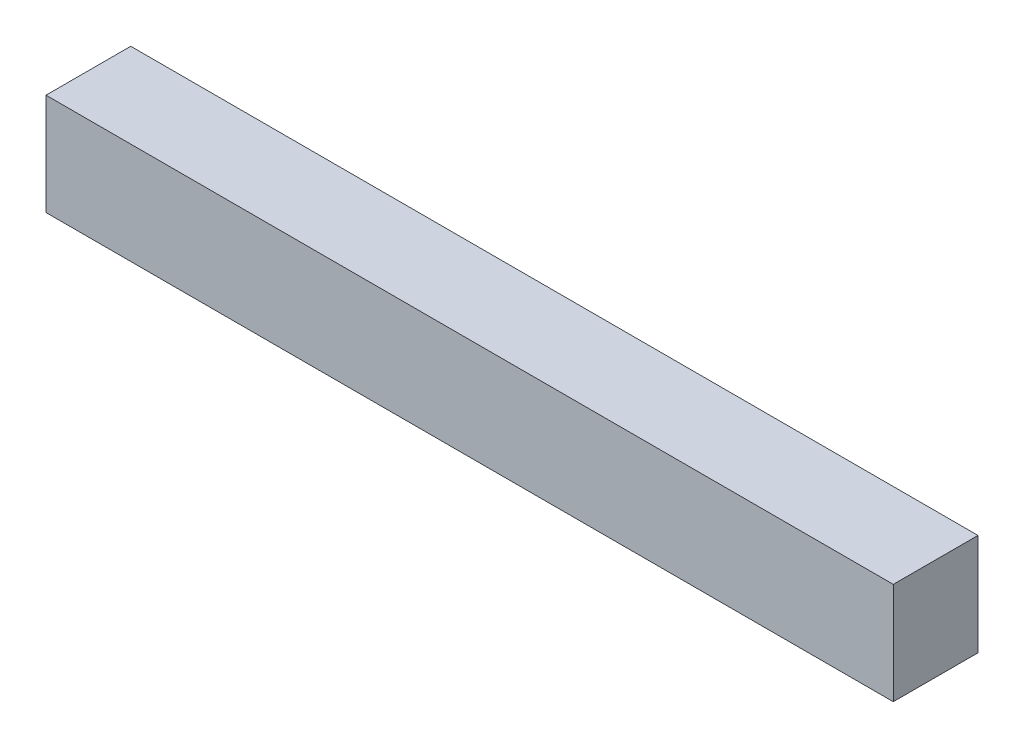
from build123d import *

# Parameters (mm, degrees)
SKETCH1_W           = 50
SKETCH1_H           = 5
BOSS_EXTRUDE1_DEPTH = 6


with BuildPart() as part:
    # Sketch1 → Boss-Extrude1 (new body)
    with BuildSketch(Plane(origin=(0, 0, 0), x_dir=(1, 0, 0), z_dir=(0, 1, 0))):
        Rectangle(SKETCH1_W, SKETCH1_H)
    extrude(amount=BOSS_EXTRUDE1_DEPTH)


solid = part.part
